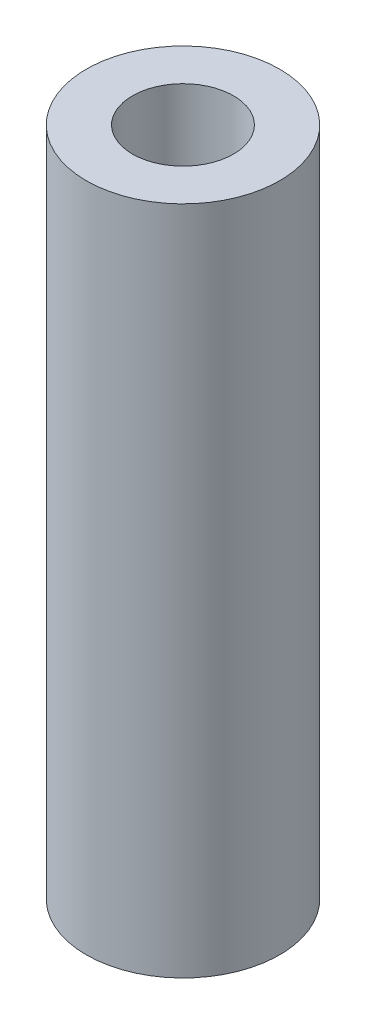
from build123d import *

# Parameters (mm, degrees)
SKETCH1_R           = 4.7625
SKETCH1_R_2         = 2.4892
BOSS_EXTRUDE1_DEPTH = 33.02


with BuildPart() as part:
    # Sketch1 → Boss-Extrude1 (new body)
    with BuildSketch(Plane(origin=(0, 0, 0), x_dir=(1, 0, 0), z_dir=(0, 1, 0))):
        with Locations(Location((0, 0, 0), (0, 0, 270))):
            Circle(SKETCH1_R)
        with Locations(Location((0, 0, 0), (0, 0, 270))):
            Circle(SKETCH1_R_2, mode=Mode.SUBTRACT)
    extrude(amount=BOSS_EXTRUDE1_DEPTH)


solid = part.part
